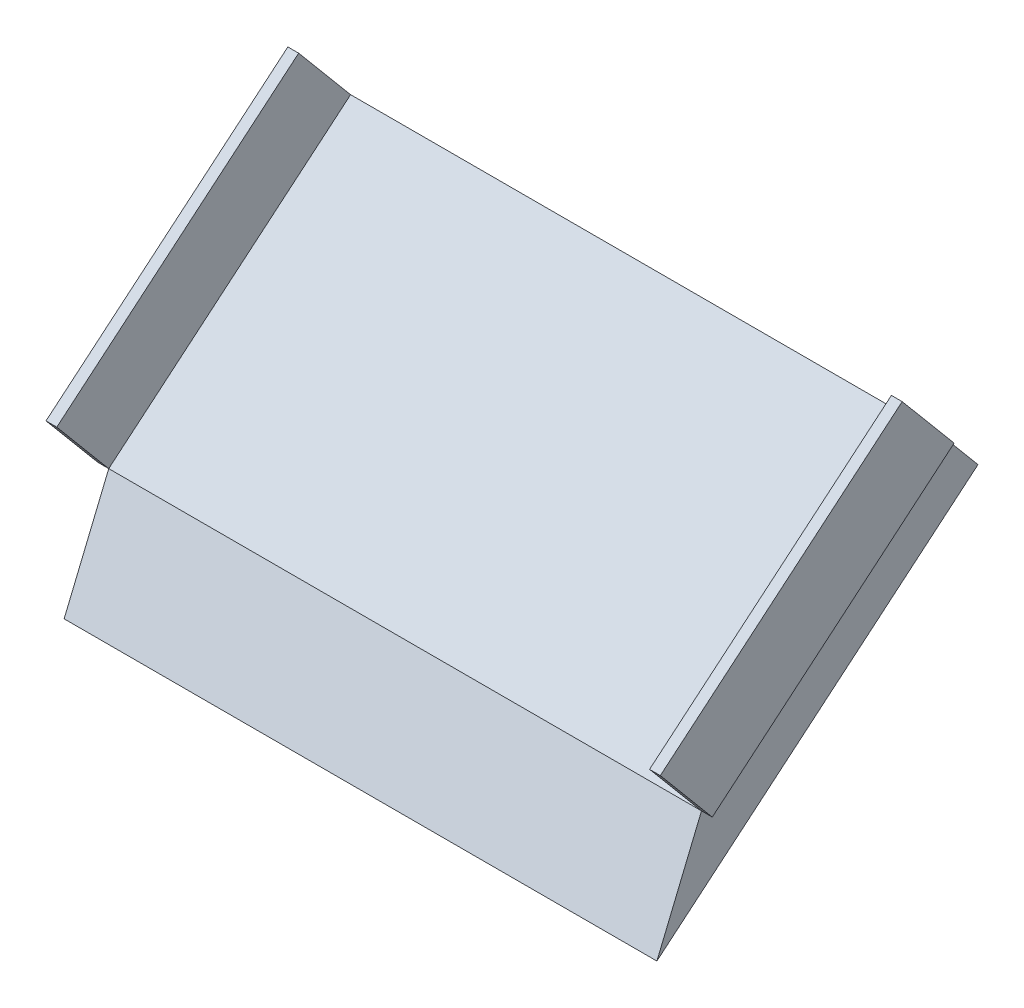
from build123d import *

# Parameters (mm, degrees)
BOSS_EXTRUDE2_DEPTH = 1100
BOSS_EXTRUDE3_DEPTH = 20
BOSS_EXTRUDE4_DEPTH = 20


with BuildPart() as part:
    # Sketch1 → Boss-Extrude2 (new body)
    with BuildSketch(Plane(origin=(0, 0, 0), x_dir=(0, 0, -1), z_dir=(1, 0, 0))):
        Polygon((-357.526077778, -300), (0, 0), (-64.278760969, 76.604444312), (-513.098460464, -300), (-595.876796297, -500), align=None)
    extrude(amount=BOSS_EXTRUDE2_DEPTH)


with BuildPart() as body_2:
    # Sketch2 → Boss-Extrude3 (new body)
    with BuildSketch(Plane(origin=(1100, 0, 0), x_dir=(0, 0, -1), z_dir=(1, 0, 0))):
        Polygon((-609.516601917, -185.093333532), (-513.098460464, -300), (-64.278760969, 76.604444312), (-160.696902422, 191.51111078), align=None)
    extrude(amount=BOSS_EXTRUDE3_DEPTH)


with BuildPart() as body_3:
    # Sketch3 → Boss-Extrude4 (new body)
    with BuildSketch(Plane.ZY):
        Polygon((64.278760969, 76.604444312), (160.696902422, 191.51111078), (609.516601917, -185.093333532), (513.098460464, -300), align=None)
    extrude(amount=BOSS_EXTRUDE4_DEPTH)


solid = Compound([part.part, body_2.part, body_3.part])
